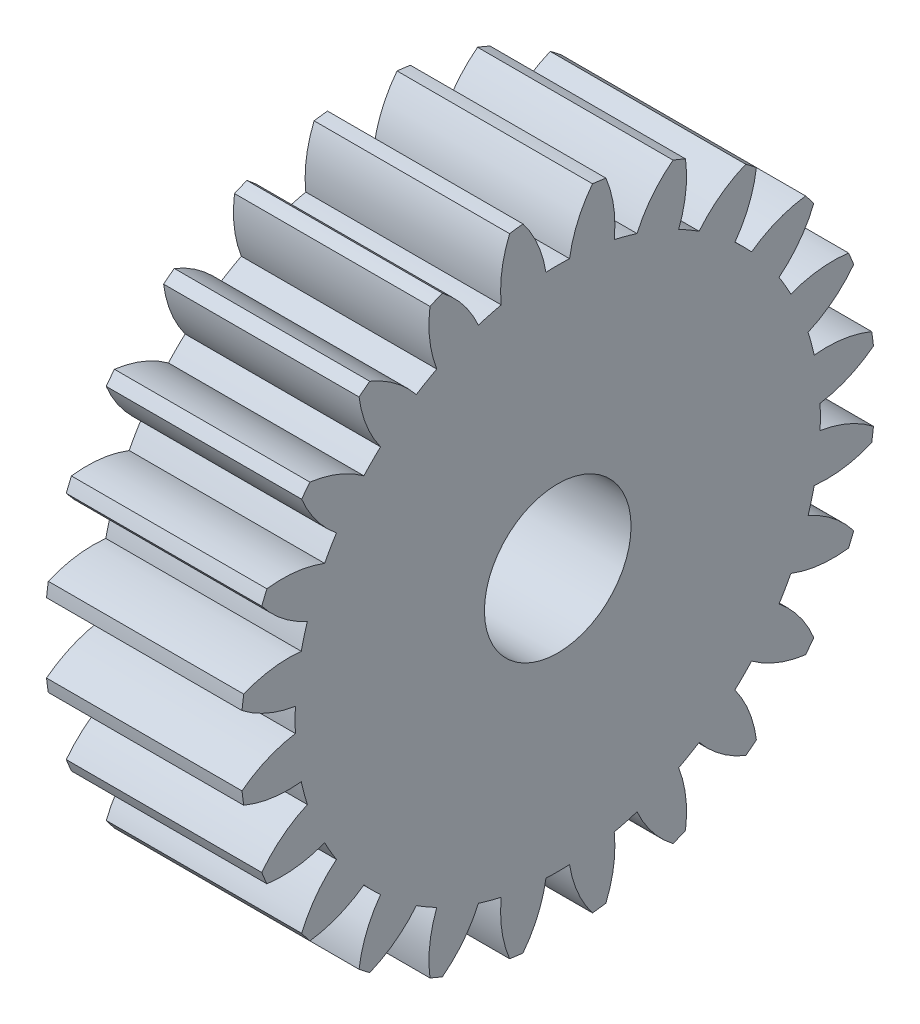
from build123d import *

# Parameters (mm, degrees)
SKETCH_1_R      = 1.5
EXTRUDE_1_DEPTH = 4
CHAMFER_1_SIZE  = 0.1


with BuildPart() as part:
    # 草图1 → 凸台-拉伸1 (new body)
    with BuildSketch(Plane(origin=(4, 0, 0), x_dir=(0, 0, -1), z_dir=(1, 0, 0))):
        with BuildLine():
            ThreePointArc((-5.368564348, 0.241646108), (-5.374, 0), (-5.368564348, -0.241646108))
            ThreePointArc((-5.368564348, -0.241646108), (-5.94431135, -0.407766737), (-6.460959589, -0.711337602))
            ThreePointArc((-6.460959589, -0.711337602), (-6.444391599, -0.848420249), (-6.424915449, -0.98512003))
            ThreePointArc((-6.424915449, -0.98512003), (-5.84730165, -1.144628565), (-5.248177569, -1.156074481))
            ThreePointArc((-5.248177569, -1.156074481), (-5.19088539, -1.390893548), (-5.123092339, -1.622898915))
            ThreePointArc((-5.123092339, -1.622898915), (-5.636226055, -1.93237341), (-6.056700011, -2.359318752))
            ThreePointArc((-6.056700011, -2.359318752), (-6.005216961, -2.48744231), (-5.951023938, -2.614443361))
            ThreePointArc((-5.951023938, -2.614443361), (-5.351808006, -2.619019322), (-4.770136161, -2.475010506))
            ThreePointArc((-4.770136161, -2.475010506), (-4.65402052, -2.687), (-4.528490053, -2.893553842))
            ThreePointArc((-4.528490053, -2.893553842), (-4.944041268, -3.325292028), (-5.239686336, -3.846516229))
            ThreePointArc((-5.239686336, -3.846516229), (-5.156796712, -3.956949289), (-5.071579981, -4.065596697))
            ThreePointArc((-5.071579981, -4.065596697), (-4.49159749, -3.91492824), (-3.967017857, -3.625278654))
            ThreePointArc((-3.967017857, -3.625278654), (-3.799991842, -3.799991842), (-3.625278654, -3.967017857))
            ThreePointArc((-3.625278654, -3.967017857), (-3.91492824, -4.49159749), (-4.065596697, -5.071579981))
            ThreePointArc((-4.065596697, -5.071579981), (-3.956949289, -5.156796712), (-3.846516229, -5.239686336))
            ThreePointArc((-3.846516229, -5.239686336), (-3.325292028, -4.944041268), (-2.893553842, -4.528490053))
            ThreePointArc((-2.893553842, -4.528490053), (-2.687, -4.65402052), (-2.475010506, -4.770136161))
            ThreePointArc((-2.475010506, -4.770136161), (-2.619019322, -5.351808006), (-2.614443361, -5.951023938))
            ThreePointArc((-2.614443361, -5.951023938), (-2.48744231, -6.005216961), (-2.359318752, -6.056700011))
            ThreePointArc((-2.359318752, -6.056700011), (-1.93237341, -5.636226055), (-1.622898915, -5.123092339))
            ThreePointArc((-1.622898915, -5.123092339), (-1.390893548, -5.19088539), (-1.156074481, -5.248177569))
            ThreePointArc((-1.156074481, -5.248177569), (-1.144628565, -5.84730165), (-0.98512003, -6.424915449))
            ThreePointArc((-0.98512003, -6.424915449), (-0.848420249, -6.444391599), (-0.711337602, -6.460959589))
            ThreePointArc((-0.711337602, -6.460959589), (-0.407766737, -5.94431135), (-0.241646108, -5.368564348))
            ThreePointArc((-0.241646108, -5.368564348), (0, -5.374), (0.241646108, -5.368564348))
            ThreePointArc((0.241646108, -5.368564348), (0.407766737, -5.94431135), (0.711337602, -6.460959589))
            ThreePointArc((0.711337602, -6.460959589), (0.848420249, -6.444391599), (0.98512003, -6.424915449))
            ThreePointArc((0.98512003, -6.424915449), (1.144628565, -5.84730165), (1.156074481, -5.248177569))
            ThreePointArc((1.156074481, -5.248177569), (1.390893548, -5.19088539), (1.622898915, -5.123092339))
            ThreePointArc((1.622898915, -5.123092339), (1.93237341, -5.636226055), (2.359318752, -6.056700011))
            ThreePointArc((2.359318752, -6.056700011), (2.48744231, -6.005216961), (2.614443361, -5.951023938))
            ThreePointArc((2.614443361, -5.951023938), (2.619019322, -5.351808006), (2.475010506, -4.770136161))
            ThreePointArc((2.475010506, -4.770136161), (2.687, -4.65402052), (2.893553842, -4.528490053))
            ThreePointArc((2.893553842, -4.528490053), (3.325292028, -4.944041268), (3.846516229, -5.239686336))
            ThreePointArc((3.846516229, -5.239686336), (3.956949289, -5.156796712), (4.065596697, -5.071579981))
            ThreePointArc((4.065596697, -5.071579981), (3.91492824, -4.49159749), (3.625278654, -3.967017857))
            ThreePointArc((3.625278654, -3.967017857), (3.799991842, -3.799991842), (3.967017857, -3.625278654))
            ThreePointArc((3.967017857, -3.625278654), (4.49159749, -3.91492824), (5.071579981, -4.065596697))
            ThreePointArc((5.071579981, -4.065596697), (5.156796712, -3.956949289), (5.239686336, -3.846516229))
            ThreePointArc((5.239686336, -3.846516229), (4.944041268, -3.325292028), (4.528490053, -2.893553842))
            ThreePointArc((4.528490053, -2.893553842), (4.65402052, -2.687), (4.770136161, -2.475010506))
            ThreePointArc((4.770136161, -2.475010506), (5.351808006, -2.619019322), (5.951023938, -2.614443361))
            ThreePointArc((5.951023938, -2.614443361), (6.005216961, -2.48744231), (6.056700011, -2.359318752))
            ThreePointArc((6.056700011, -2.359318752), (5.636226055, -1.93237341), (5.123092339, -1.622898915))
            ThreePointArc((5.123092339, -1.622898915), (5.19088539, -1.390893548), (5.248177569, -1.156074481))
            ThreePointArc((5.248177569, -1.156074481), (5.84730165, -1.144628565), (6.424915449, -0.98512003))
            ThreePointArc((6.424915449, -0.98512003), (6.444391599, -0.848420249), (6.460959589, -0.711337602))
            ThreePointArc((6.460959589, -0.711337602), (5.94431135, -0.407766737), (5.368564348, -0.241646108))
            ThreePointArc((5.368564348, -0.241646108), (5.374, 0), (5.368564348, 0.241646108))
            ThreePointArc((5.368564348, 0.241646108), (5.94431135, 0.407766737), (6.460959589, 0.711337602))
            ThreePointArc((6.460959589, 0.711337602), (6.444391599, 0.848420249), (6.424915449, 0.98512003))
            ThreePointArc((6.424915449, 0.98512003), (5.84730165, 1.144628565), (5.248177569, 1.156074481))
            ThreePointArc((5.248177569, 1.156074481), (5.19088539, 1.390893548), (5.123092339, 1.622898915))
            ThreePointArc((5.123092339, 1.622898915), (5.636226055, 1.93237341), (6.056700011, 2.359318752))
            ThreePointArc((6.056700011, 2.359318752), (6.005216961, 2.48744231), (5.951023938, 2.614443361))
            ThreePointArc((5.951023938, 2.614443361), (5.351808006, 2.619019322), (4.770136161, 2.475010506))
            ThreePointArc((4.770136161, 2.475010506), (4.65402052, 2.687), (4.528490053, 2.893553842))
            ThreePointArc((4.528490053, 2.893553842), (4.944041268, 3.325292028), (5.239686336, 3.846516229))
            ThreePointArc((5.239686336, 3.846516229), (5.156796712, 3.956949289), (5.071579981, 4.065596697))
            ThreePointArc((5.071579981, 4.065596697), (4.49159749, 3.91492824), (3.967017857, 3.625278654))
            ThreePointArc((3.967017857, 3.625278654), (3.799991842, 3.799991842), (3.625278654, 3.967017857))
            ThreePointArc((3.625278654, 3.967017857), (3.91492824, 4.49159749), (4.065596697, 5.071579981))
            ThreePointArc((4.065596697, 5.071579981), (3.956949289, 5.156796712), (3.846516229, 5.239686336))
            ThreePointArc((3.846516229, 5.239686336), (3.325292028, 4.944041268), (2.893553842, 4.528490053))
            ThreePointArc((2.893553842, 4.528490053), (2.687, 4.65402052), (2.475010506, 4.770136161))
            ThreePointArc((2.475010506, 4.770136161), (2.619019322, 5.351808006), (2.614443361, 5.951023938))
            ThreePointArc((2.614443361, 5.951023938), (2.48744231, 6.005216961), (2.359318752, 6.056700011))
            ThreePointArc((2.359318752, 6.056700011), (1.93237341, 5.636226055), (1.622898915, 5.123092339))
            ThreePointArc((1.622898915, 5.123092339), (1.390893548, 5.19088539), (1.156074481, 5.248177569))
            ThreePointArc((1.156074481, 5.248177569), (1.144628565, 5.84730165), (0.98512003, 6.424915449))
            ThreePointArc((0.98512003, 6.424915449), (0.848420249, 6.444391599), (0.711337602, 6.460959589))
            ThreePointArc((0.711337602, 6.460959589), (0.407766737, 5.94431135), (0.241646108, 5.368564348))
            ThreePointArc((0.241646108, 5.368564348), (0, 5.374), (-0.241646108, 5.368564348))
            ThreePointArc((-0.241646108, 5.368564348), (-0.407766737, 5.94431135), (-0.711337602, 6.460959589))
            ThreePointArc((-0.711337602, 6.460959589), (-0.848420249, 6.444391599), (-0.98512003, 6.424915449))
            ThreePointArc((-0.98512003, 6.424915449), (-1.144628565, 5.84730165), (-1.156074481, 5.248177569))
            ThreePointArc((-1.156074481, 5.248177569), (-1.390893548, 5.19088539), (-1.622898915, 5.123092339))
            ThreePointArc((-1.622898915, 5.123092339), (-1.93237341, 5.636226055), (-2.359318752, 6.056700011))
            ThreePointArc((-2.359318752, 6.056700011), (-2.48744231, 6.005216961), (-2.614443361, 5.951023938))
            ThreePointArc((-2.614443361, 5.951023938), (-2.619019322, 5.351808006), (-2.475010506, 4.770136161))
            ThreePointArc((-2.475010506, 4.770136161), (-2.687, 4.65402052), (-2.893553842, 4.528490053))
            ThreePointArc((-2.893553842, 4.528490053), (-3.325292028, 4.944041268), (-3.846516229, 5.239686336))
            ThreePointArc((-3.846516229, 5.239686336), (-3.956949289, 5.156796712), (-4.065596697, 5.071579981))
            ThreePointArc((-4.065596697, 5.071579981), (-3.91492824, 4.49159749), (-3.625278654, 3.967017857))
            ThreePointArc((-3.625278654, 3.967017857), (-3.799991842, 3.799991842), (-3.967017857, 3.625278654))
            ThreePointArc((-3.967017857, 3.625278654), (-4.49159749, 3.91492824), (-5.071579981, 4.065596697))
            ThreePointArc((-5.071579981, 4.065596697), (-5.156796712, 3.956949289), (-5.239686336, 3.846516229))
            ThreePointArc((-5.239686336, 3.846516229), (-4.944041268, 3.325292028), (-4.528490053, 2.893553842))
            ThreePointArc((-4.528490053, 2.893553842), (-4.65402052, 2.687), (-4.770136161, 2.475010506))
            ThreePointArc((-4.770136161, 2.475010506), (-5.351808006, 2.619019322), (-5.951023938, 2.614443361))
            ThreePointArc((-5.951023938, 2.614443361), (-6.005216961, 2.48744231), (-6.056700011, 2.359318752))
            ThreePointArc((-6.056700011, 2.359318752), (-5.636226055, 1.93237341), (-5.123092339, 1.622898915))
            ThreePointArc((-5.123092339, 1.622898915), (-5.19088539, 1.390893548), (-5.248177569, 1.156074481))
            ThreePointArc((-5.248177569, 1.156074481), (-5.84730165, 1.144628565), (-6.424915449, 0.98512003))
            ThreePointArc((-6.424915449, 0.98512003), (-6.444391599, 0.848420249), (-6.460959589, 0.711337602))
            ThreePointArc((-6.460959589, 0.711337602), (-5.94431135, 0.407766737), (-5.368564348, 0.241646108))
        make_face()
        with Locations(Location((0, 0, 0), (0, 0, 180))):
            Circle(SKETCH_1_R, mode=Mode.SUBTRACT)
    extrude(amount=-EXTRUDE_1_DEPTH)

    # 倒角1
    chamfer_1_edges = [part.edges().sort_by_distance(p)[0] for p in [
        (0, 0, -1.5),
    ]]
    chamfer(chamfer_1_edges, length=CHAMFER_1_SIZE)


solid = part.part
